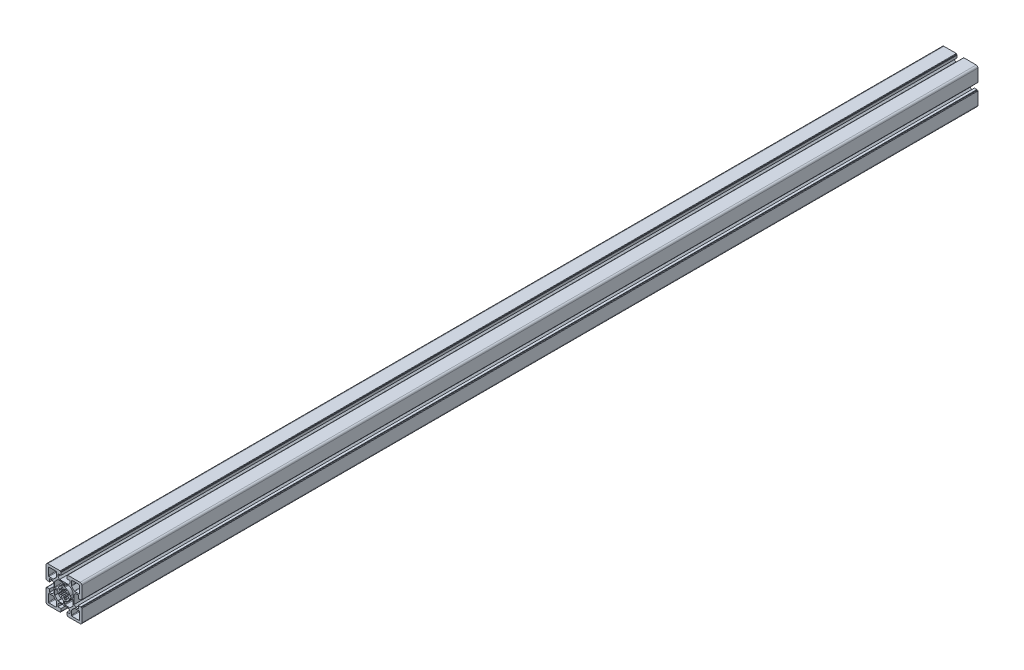
from build123d import *

# Parameters (mm, degrees)
BASE_EXTRUDE_DEPTH = 1500
ESCALA1_SCALE      = 0.5


with BuildPart() as part:
    # Sketch1 → Base-Extrude (new body)
    with BuildSketch(Plane.XY):
        with BuildLine():
            Line((7.24997588, 17.000014817), (-2.412e-05, 17.000014817))
            Line((-2.412e-05, 17.000014817), (-7.25002412, 17.000014817))
            Line((-7.25002412, 17.000014817), (-10.05002512, 19.800013819))
            Line((-10.05002512, 19.800013819), (-10.05002512, 24.000014819))
            Line((-10.05002512, 24.000014819), (-5.00002412, 24.000014819))
            Line((-5.00002412, 24.000014819), (-5.00002412, 28.20002069))
            ThreePointArc((-5.00002412, 28.20002069), (-5.08789044, 28.41214864), (-5.300018455, 28.500014819))
            Line((-5.300018455, 28.500014819), (-5.500021455, 28.500014819))
            ThreePointArc((-5.500021455, 28.500014819), (-5.712152769, 28.587882347), (-5.800020455, 28.800013596))
            Line((-5.800020455, 28.800013596), (-5.800020455, 29.500015192))
            ThreePointArc((-5.800020455, 29.500015192), (-5.946466955, 29.853568318), (-6.300020081, 30.000014817))
            Line((-6.300020081, 30.000014817), (-27.000022696, 30.000014817))
            ThreePointArc((-27.000022696, 30.000014817), (-29.121341455, 29.121335817), (-30.000020455, 27.000017059))
            Line((-30.000020455, 27.000017059), (-30.000020455, 6.300013444))
            ThreePointArc((-30.000020455, 6.300013444), (-29.853573955, 5.946460317), (-29.500020828, 5.800013817))
            Line((-29.500020828, 5.800013817), (-28.800019731, 5.800013817))
            ThreePointArc((-28.800019731, 5.800013817), (-28.587888208, 5.712146064), (-28.500020455, 5.500014542))
            Line((-28.500020455, 5.500014542), (-28.500020455, 5.300014093))
            ThreePointArc((-28.500020455, 5.300014093), (-28.412152701, 5.087882571), (-28.200021179, 5.000014817))
            Line((-28.200021179, 5.000014817), (-24.000020455, 5.000014817))
            Line((-24.000020455, 5.000014817), (-24.000020455, 10.050012866))
            Line((-24.000020455, 10.050012866), (-19.800019665, 10.050012866))
            Line((-19.800019665, 10.050012866), (-17.000019665, 7.250013866))
            Line((-17.000019665, 7.250013866), (-17.000019665, 4.3167e-05))
            Line((-17.000019665, 4.3167e-05), (-17.000019665, -7.249956831))
            Line((-17.000019665, -7.249956831), (-19.800019665, -10.049955831))
            Line((-19.800019665, -10.049955831), (-24.000020455, -10.049955831))
            Line((-24.000020455, -10.049955831), (-24.000020455, -4.999957783))
            Line((-24.000020455, -4.999957783), (-28.200021179, -4.999957783))
            ThreePointArc((-28.200021179, -4.999957783), (-28.412152701, -5.087825536), (-28.500020455, -5.299957058))
            Line((-28.500020455, -5.299957058), (-28.500020455, -5.499957507))
            ThreePointArc((-28.500020455, -5.499957507), (-28.587888208, -5.712089029), (-28.800019731, -5.799956783))
            Line((-28.800019731, -5.799956783), (-29.500020828, -5.799956783))
            ThreePointArc((-29.500020828, -5.799956783), (-29.853573955, -5.946403283), (-30.000020455, -6.299956409))
            Line((-30.000020455, -6.299956409), (-30.000020455, -26.999960024))
            ThreePointArc((-30.000020455, -26.999960024), (-29.121341455, -29.121278783), (-27.000022696, -29.999957783))
            Line((-27.000022696, -29.999957783), (-6.300020081, -29.999957783))
            ThreePointArc((-6.300020081, -29.999957783), (-5.946466955, -29.853511283), (-5.800020455, -29.499958157))
            Line((-5.800020455, -29.499958157), (-5.800020455, -28.799956561))
            ThreePointArc((-5.800020455, -28.799956561), (-5.712152769, -28.587825312), (-5.500021455, -28.499957784))
            Line((-5.500021455, -28.499957784), (-5.300018455, -28.499957784))
            ThreePointArc((-5.300018455, -28.499957784), (-5.08789044, -28.412091605), (-5.00002412, -28.199963655))
            Line((-5.00002412, -28.199963655), (-5.00002412, -23.999957784))
            Line((-5.00002412, -23.999957784), (-10.05002512, -23.999957784))
            Line((-10.05002512, -23.999957784), (-10.05002512, -19.799956784))
            Line((-10.05002512, -19.799956784), (-7.25002412, -16.999957783))
            Line((-7.25002412, -16.999957783), (-2.412e-05, -16.999957783))
            Line((-2.412e-05, -16.999957783), (7.24997588, -16.999957783))
            Line((7.24997588, -16.999957783), (10.04997688, -19.799956784))
            Line((10.04997688, -19.799956784), (10.04997688, -23.999957784))
            Line((10.04997688, -23.999957784), (4.99997588, -23.999957784))
            Line((4.99997588, -23.999957784), (4.99997588, -28.199963655))
            ThreePointArc((4.99997588, -28.199963655), (5.0878422, -28.412091605), (5.299970215, -28.499957784))
            Line((5.299970215, -28.499957784), (5.499973215, -28.499957784))
            ThreePointArc((5.499973215, -28.499957784), (5.71210453, -28.587825312), (5.799972216, -28.799956561))
            Line((5.799972216, -28.799956561), (5.799972216, -29.499958157))
            ThreePointArc((5.799972216, -29.499958157), (5.946418716, -29.853511283), (6.299971842, -29.999957783))
            Line((6.299971842, -29.999957783), (26.999974457, -29.999957783))
            ThreePointArc((26.999974457, -29.999957783), (29.121293215, -29.121278783), (29.999972215, -26.999960024))
            Line((29.999972215, -26.999960024), (29.999972215, -6.299956409))
            ThreePointArc((29.999972215, -6.299956409), (29.853525715, -5.946403283), (29.499972589, -5.799956783))
            Line((29.499972589, -5.799956783), (28.799971491, -5.799956783))
            ThreePointArc((28.799971491, -5.799956783), (28.587839969, -5.712089029), (28.499972215, -5.499957507))
            Line((28.499972215, -5.499957507), (28.499972215, -5.299957058))
            ThreePointArc((28.499972215, -5.299957058), (28.412104462, -5.087825536), (28.199972939, -4.999957783))
            Line((28.199972939, -4.999957783), (23.999972215, -4.999957783))
            Line((23.999972215, -4.999957783), (23.999972215, -10.049955831))
            Line((23.999972215, -10.049955831), (19.799971426, -10.049955831))
            Line((19.799971426, -10.049955831), (16.999971426, -7.249956831))
            Line((16.999971426, -7.249956831), (16.999971426, 4.3167e-05))
            Line((16.999971426, 4.3167e-05), (16.999971426, 7.250013866))
            Line((16.999971426, 7.250013866), (19.799971426, 10.050012866))
            Line((19.799971426, 10.050012866), (23.999972215, 10.050012866))
            Line((23.999972215, 10.050012866), (23.999972215, 5.000014817))
            Line((23.999972215, 5.000014817), (28.199972939, 5.000014817))
            ThreePointArc((28.199972939, 5.000014817), (28.412104462, 5.087882571), (28.499972215, 5.300014093))
            Line((28.499972215, 5.300014093), (28.499972215, 5.500014542))
            ThreePointArc((28.499972215, 5.500014542), (28.587839969, 5.712146064), (28.799971491, 5.800013817))
            Line((28.799971491, 5.800013817), (29.499972589, 5.800013817))
            ThreePointArc((29.499972589, 5.800013817), (29.853525715, 5.946460317), (29.999972215, 6.300013444))
            Line((29.999972215, 6.300013444), (29.999972215, 27.000017059))
            ThreePointArc((29.999972215, 27.000017059), (29.121293215, 29.121335817), (26.999974457, 30.000014817))
            Line((26.999974457, 30.000014817), (6.299971842, 30.000014817))
            ThreePointArc((6.299971842, 30.000014817), (5.946418716, 29.853568318), (5.799972216, 29.500015192))
            Line((5.799972216, 29.500015192), (5.799972216, 28.800013596))
            ThreePointArc((5.799972216, 28.800013596), (5.71210453, 28.587882347), (5.499973215, 28.500014819))
            Line((5.499973215, 28.500014819), (5.299970215, 28.500014819))
            ThreePointArc((5.299970215, 28.500014819), (5.0878422, 28.41214864), (4.99997588, 28.20002069))
            Line((4.99997588, 28.20002069), (4.99997588, 24.000014819))
            Line((4.99997588, 24.000014819), (10.04997688, 24.000014819))
            Line((10.04997688, 24.000014819), (10.04997688, 19.800013819))
            Line((10.04997688, 19.800013819), (7.24997588, 17.000014817))
        make_face()
        with BuildLine():
            Line((24.999970687, 12.300015508), (17.964182773, 12.300015508))
            ThreePointArc((17.964182773, 12.300015508), (17.581498992, 12.376136067), (17.257075378, 12.59290907))
            Line((17.257075378, 12.59290907), (12.592863552, 17.257122896))
            ThreePointArc((12.592863552, 17.257122896), (12.376090508, 17.581546796), (12.29996994, 17.964230842))
            Line((12.29996994, 17.964230842), (12.29996994, 25.000017255))
            ThreePointArc((12.29996994, 25.000017255), (12.59286294, 25.707123508), (13.299969193, 26.000016508))
            Line((13.299969193, 26.000016508), (24.999970687, 26.000016508))
            ThreePointArc((24.999970687, 26.000016508), (25.70707694, 25.707123508), (25.99996994, 25.000017255))
            Line((25.99996994, 25.000017255), (25.99996994, 13.300014761))
            ThreePointArc((25.99996994, 13.300014761), (25.70707694, 12.592908508), (24.999970687, 12.300015508))
        make_face(mode=Mode.SUBTRACT)
        with BuildLine():
            Line((-0.868254781, 4.924047323), (-1.389203942, 7.878492919))
            ThreePointArc((-1.389203942, 7.878492919), (-3.061491097, 7.391065963), (-4.588639176, 6.553242527))
            Line((-4.588639176, 6.553242527), (-2.867900032, 4.095774325))
            ThreePointArc((-2.867900032, 4.095774325), (-3.535545186, 3.535556326), (-4.095767305, 2.867914629))
            Line((-4.095767305, 2.867914629), (-6.553231573, 4.588649719))
            ThreePointArc((-6.553231573, 4.588649719), (-7.391053065, 3.061505388), (-7.878479822, 1.389222571))
            Line((-7.878479822, 1.389222571), (-4.924052211, 0.868276934))
            ThreePointArc((-4.924052211, 0.868276934), (-5.000015145, 2.8517e-05), (-4.924052211, -0.8682199))
            Line((-4.924052211, -0.8682199), (-7.878479822, -1.389165536))
            ThreePointArc((-7.878479822, -1.389165536), (-7.391053065, -3.061448353), (-6.553231573, -4.588592684))
            Line((-6.553231573, -4.588592684), (-4.095767305, -2.867857594))
            ThreePointArc((-4.095767305, -2.867857594), (-3.535545186, -3.535499291), (-2.867900032, -4.09571729))
            Line((-2.867900032, -4.09571729), (-4.588639176, -6.553185492))
            ThreePointArc((-4.588639176, -6.553185492), (-3.061491097, -7.391008929), (-1.389203942, -7.878435884))
            Line((-1.389203942, -7.878435884), (-0.868254781, -4.923990288))
            ThreePointArc((-0.868254781, -4.923990288), (-0.435797618, -4.980922606), (-2.412e-05, -4.999947433))
            ThreePointArc((-2.412e-05, -4.999947433), (0.435749379, -4.980922606), (0.868206541, -4.923990288))
            Line((0.868206541, -4.923990288), (1.389155702, -7.878435884))
            ThreePointArc((1.389155702, -7.878435884), (3.061442857, -7.391008929), (4.588590936, -6.553185492))
            Line((4.588590936, -6.553185492), (2.867851793, -4.09571729))
            ThreePointArc((2.867851793, -4.09571729), (3.535496947, -3.535499291), (4.095719065, -2.867857594))
            Line((4.095719065, -2.867857594), (6.553183334, -4.588592684))
            ThreePointArc((6.553183334, -4.588592684), (7.391004826, -3.061448353), (7.878431582, -1.389165536))
            Line((7.878431582, -1.389165536), (4.924003972, -0.8682199))
            ThreePointArc((4.924003972, -0.8682199), (4.999966905, 2.8517e-05), (4.924003972, 0.868276934))
            Line((4.924003972, 0.868276934), (7.878431582, 1.389222571))
            ThreePointArc((7.878431582, 1.389222571), (7.391004826, 3.061505388), (6.553183334, 4.588649719))
            Line((6.553183334, 4.588649719), (4.095719065, 2.867914629))
            ThreePointArc((4.095719065, 2.867914629), (3.535496947, 3.535556326), (2.867851793, 4.095774325))
            Line((2.867851793, 4.095774325), (4.588590936, 6.553242527))
            ThreePointArc((4.588590936, 6.553242527), (3.061442857, 7.391065963), (1.389155702, 7.878492919))
            Line((1.389155702, 7.878492919), (0.868206541, 4.924047323))
            ThreePointArc((0.868206541, 4.924047323), (0.435749379, 4.980979641), (-2.412e-05, 5.000004467))
            ThreePointArc((-2.412e-05, 5.000004467), (-0.435797618, 4.980979641), (-0.868254781, 4.924047323))
        make_face(mode=Mode.SUBTRACT)
        with BuildLine():
            Line((14.499970687, 1.000016508), (10.969128525, 1.000016508))
            ThreePointArc((10.969128525, 1.000016508), (10.328572063, 1.232105996), (9.985348997, 1.820643198))
            ThreePointArc((9.985348997, 1.820643198), (7.177103386, 7.177150109), (1.820595849, 9.985394525))
            ThreePointArc((1.820595849, 9.985394525), (1.232058499, 10.328617545), (0.99996894, 10.969174093))
            Line((0.99996894, 10.969174093), (0.99996894, 14.500017255))
            ThreePointArc((0.99996894, 14.500017255), (1.29286194, 15.207123508), (1.999968193, 15.500016508))
            Line((1.999968193, 15.500016508), (9.900222627, 15.500016508))
            ThreePointArc((9.900222627, 15.500016508), (10.091564812, 15.461956186), (10.253776891, 15.353569557))
            Line((10.253776891, 15.353569557), (15.35352292, 10.253824528))
            ThreePointArc((15.35352292, 10.253824528), (15.461909599, 10.091612425), (15.49996994, 9.900270195))
            Line((15.49996994, 9.900270195), (15.49996994, 2.000015761))
            ThreePointArc((15.49996994, 2.000015761), (15.20707694, 1.292909508), (14.499970687, 1.000016508))
        make_face(mode=Mode.SUBTRACT)
        with BuildLine():
            Line((-25.000018927, -12.299958473), (-17.964231013, -12.299958473))
            ThreePointArc((-17.964231013, -12.299958473), (-17.581547231, -12.376079032), (-17.257123618, -12.592852035))
            Line((-17.257123618, -12.592852035), (-12.592911792, -17.257065861))
            ThreePointArc((-12.592911792, -17.257065861), (-12.376138748, -17.581489761), (-12.30001818, -17.964173807))
            Line((-12.30001818, -17.964173807), (-12.30001818, -24.99996022))
            ThreePointArc((-12.30001818, -24.99996022), (-12.59291118, -25.707066473), (-13.300017432, -25.999959473))
            Line((-13.300017432, -25.999959473), (-25.000018927, -25.999959473))
            ThreePointArc((-25.000018927, -25.999959473), (-25.70712518, -25.707066473), (-26.00001818, -24.99996022))
            Line((-26.00001818, -24.99996022), (-26.00001818, -13.299957726))
            ThreePointArc((-26.00001818, -13.299957726), (-25.70712518, -12.592851473), (-25.000018927, -12.299958473))
        make_face(mode=Mode.SUBTRACT)
        with BuildLine():
            Line((-14.500018927, -0.999959473), (-10.969176764, -0.999959473))
            ThreePointArc((-10.969176764, -0.999959473), (-10.328620302, -1.232048961), (-9.985397236, -1.820586163))
            ThreePointArc((-9.985397236, -1.820586163), (-7.177151626, -7.177093074), (-1.820644088, -9.98533749))
            ThreePointArc((-1.820644088, -9.98533749), (-1.232106738, -10.32856051), (-1.00001718, -10.969117058))
            Line((-1.00001718, -10.969117058), (-1.00001718, -14.49996022))
            ThreePointArc((-1.00001718, -14.49996022), (-1.29291018, -15.207066473), (-2.000016432, -15.499959473))
            Line((-2.000016432, -15.499959473), (-9.900270866, -15.499959473))
            ThreePointArc((-9.900270866, -15.499959473), (-10.091613051, -15.461899151), (-10.25382513, -15.353512523))
            Line((-10.25382513, -15.353512523), (-15.353571159, -10.253767494))
            ThreePointArc((-15.353571159, -10.253767494), (-15.461957839, -10.091555391), (-15.50001818, -9.90021316))
            Line((-15.50001818, -9.90021316), (-15.50001818, -1.999958726))
            ThreePointArc((-15.50001818, -1.999958726), (-15.20712518, -1.292852473), (-14.500018927, -0.999959473))
        make_face(mode=Mode.SUBTRACT)
        with BuildLine():
            Line((0.99996894, -10.969117058), (0.99996894, -14.49996022))
            ThreePointArc((0.99996894, -14.49996022), (1.29286194, -15.207066473), (1.999968193, -15.499959473))
            Line((1.999968193, -15.499959473), (9.900222627, -15.499959473))
            ThreePointArc((9.900222627, -15.499959473), (10.091564812, -15.461899151), (10.253776891, -15.353512523))
            Line((10.253776891, -15.353512523), (15.35352292, -10.253767494))
            ThreePointArc((15.35352292, -10.253767494), (15.461909599, -10.091555391), (15.49996994, -9.90021316))
            Line((15.49996994, -9.90021316), (15.49996994, -1.999958726))
            ThreePointArc((15.49996994, -1.999958726), (15.20707694, -1.292852473), (14.499970687, -0.999959473))
            Line((14.499970687, -0.999959473), (10.969128525, -0.999959473))
            ThreePointArc((10.969128525, -0.999959473), (10.328572063, -1.232048961), (9.985348997, -1.820586163))
            ThreePointArc((9.985348997, -1.820586163), (7.177103386, -7.177093074), (1.820595849, -9.98533749))
            ThreePointArc((1.820595849, -9.98533749), (1.232058499, -10.32856051), (0.99996894, -10.969117058))
        make_face(mode=Mode.SUBTRACT)
        with BuildLine():
            Line((-1.00001718, 10.969174093), (-1.00001718, 14.500017255))
            ThreePointArc((-1.00001718, 14.500017255), (-1.29291018, 15.207123508), (-2.000016432, 15.500016508))
            Line((-2.000016432, 15.500016508), (-9.900270866, 15.500016508))
            ThreePointArc((-9.900270866, 15.500016508), (-10.091613051, 15.461956186), (-10.25382513, 15.353569557))
            Line((-10.25382513, 15.353569557), (-15.353571159, 10.253824528))
            ThreePointArc((-15.353571159, 10.253824528), (-15.461957839, 10.091612425), (-15.50001818, 9.900270195))
            Line((-15.50001818, 9.900270195), (-15.50001818, 2.000015761))
            ThreePointArc((-15.50001818, 2.000015761), (-15.20712518, 1.292909508), (-14.500018927, 1.000016508))
            Line((-14.500018927, 1.000016508), (-10.969176764, 1.000016508))
            ThreePointArc((-10.969176764, 1.000016508), (-10.328620302, 1.232105996), (-9.985397236, 1.820643198))
            ThreePointArc((-9.985397236, 1.820643198), (-7.177151626, 7.177150109), (-1.820644088, 9.985394525))
            ThreePointArc((-1.820644088, 9.985394525), (-1.232106738, 10.328617545), (-1.00001718, 10.969174093))
        make_face(mode=Mode.SUBTRACT)
        with BuildLine():
            Line((-26.00001818, 13.300014761), (-26.00001818, 25.000017255))
            ThreePointArc((-26.00001818, 25.000017255), (-25.70712518, 25.707123508), (-25.000018927, 26.000016508))
            Line((-25.000018927, 26.000016508), (-13.300017432, 26.000016508))
            ThreePointArc((-13.300017432, 26.000016508), (-12.59291118, 25.707123508), (-12.30001818, 25.000017255))
            Line((-12.30001818, 25.000017255), (-12.30001818, 17.964230842))
            ThreePointArc((-12.30001818, 17.964230842), (-12.376138748, 17.581546796), (-12.592911792, 17.257122896))
            Line((-12.592911792, 17.257122896), (-17.257123618, 12.59290907))
            ThreePointArc((-17.257123618, 12.59290907), (-17.581547231, 12.376136067), (-17.964231013, 12.300015508))
            Line((-17.964231013, 12.300015508), (-25.000018927, 12.300015508))
            ThreePointArc((-25.000018927, 12.300015508), (-25.70712518, 12.592908508), (-26.00001818, 13.300014761))
        make_face(mode=Mode.SUBTRACT)
        with BuildLine():
            Line((25.99996994, -13.299957726), (25.99996994, -24.99996022))
            ThreePointArc((25.99996994, -24.99996022), (25.70707694, -25.707066473), (24.999970687, -25.999959473))
            Line((24.999970687, -25.999959473), (13.299969193, -25.999959473))
            ThreePointArc((13.299969193, -25.999959473), (12.59286294, -25.707066473), (12.29996994, -24.99996022))
            Line((12.29996994, -24.99996022), (12.29996994, -17.964173807))
            ThreePointArc((12.29996994, -17.964173807), (12.376090508, -17.581489761), (12.592863552, -17.257065861))
            Line((12.592863552, -17.257065861), (17.257075378, -12.592852035))
            ThreePointArc((17.257075378, -12.592852035), (17.581498992, -12.376079032), (17.964182773, -12.299958473))
            Line((17.964182773, -12.299958473), (24.999970687, -12.299958473))
            ThreePointArc((24.999970687, -12.299958473), (25.70707694, -12.592851473), (25.99996994, -13.299957726))
        make_face(mode=Mode.SUBTRACT)
    extrude(amount=-BASE_EXTRUDE_DEPTH)


with BuildPart() as part_1:
    # Escala1: scaled about (0, 0, 0)
    add(part.part.scale(ESCALA1_SCALE))


solid = part_1.part
